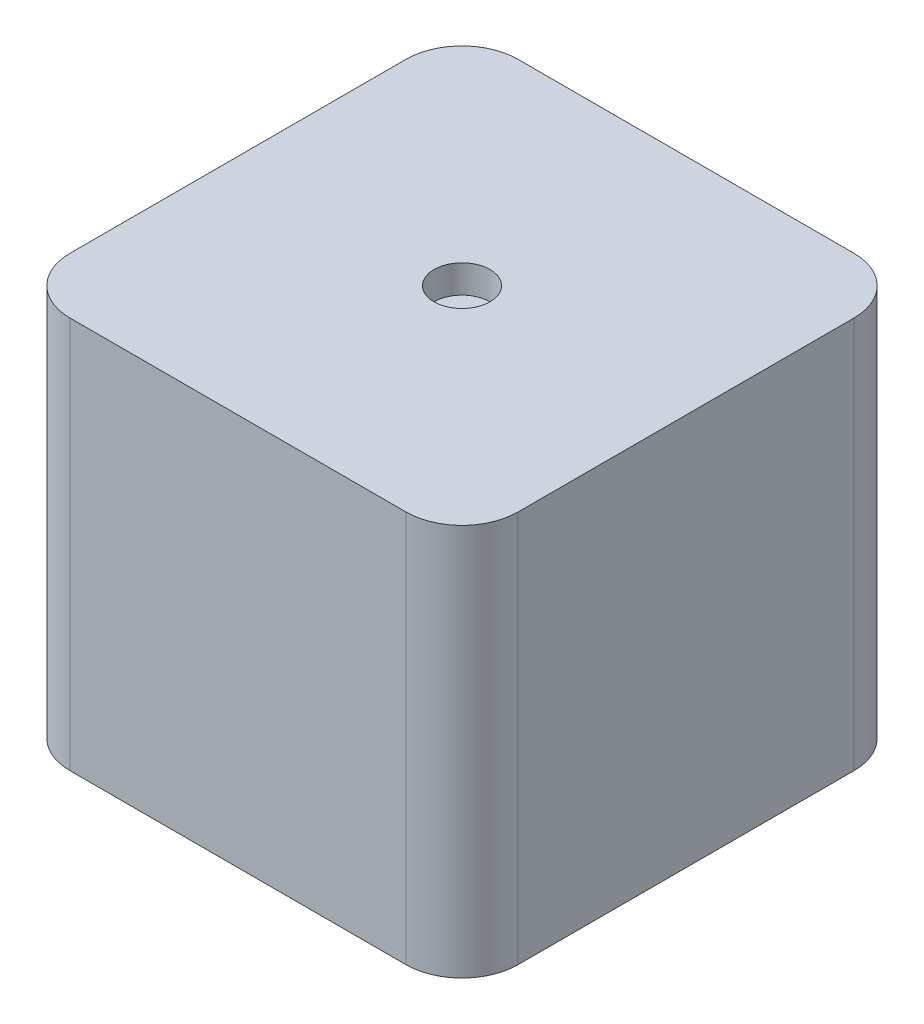
from build123d import *

# Parameters (mm, degrees)
BOSS_EXTRUDE1_DEPTH = 70
SKETCH2_R           = 5
CUT_EXTRUDE1_DEPTH  = 5


with BuildPart() as part:
    # Sketch1 → Boss-Extrude1 (new body)
    with BuildSketch(Plane(origin=(0, 0, 0), x_dir=(1, 0, 0), z_dir=(0, 1, 0))):
        with BuildLine():
            Line((-30, -40), (30, -40))
            ThreePointArc((30, -40), (37.071067812, -37.071067812), (40, -30))
            Line((40, -30), (40, 30))
            ThreePointArc((40, 30), (37.071067812, 37.071067812), (30, 40))
            Line((30, 40), (-30, 40))
            ThreePointArc((-30, 40), (-37.071067812, 37.071067812), (-40, 30))
            Line((-40, 30), (-40, -30))
            ThreePointArc((-40, -30), (-37.071067812, -37.071067812), (-30, -40))
        make_face()
    extrude(amount=BOSS_EXTRUDE1_DEPTH)

    # Sketch2 → Cut-Extrude1 (cut)
    with BuildSketch(Plane(origin=(0, 70, 0), x_dir=(1, 0, 0), z_dir=(0, 1, 0))):
        with Locations(Location((0, 0, 0), (0, 0, 270))):
            Circle(SKETCH2_R)
    extrude(amount=-CUT_EXTRUDE1_DEPTH, mode=Mode.SUBTRACT)


solid = part.part
